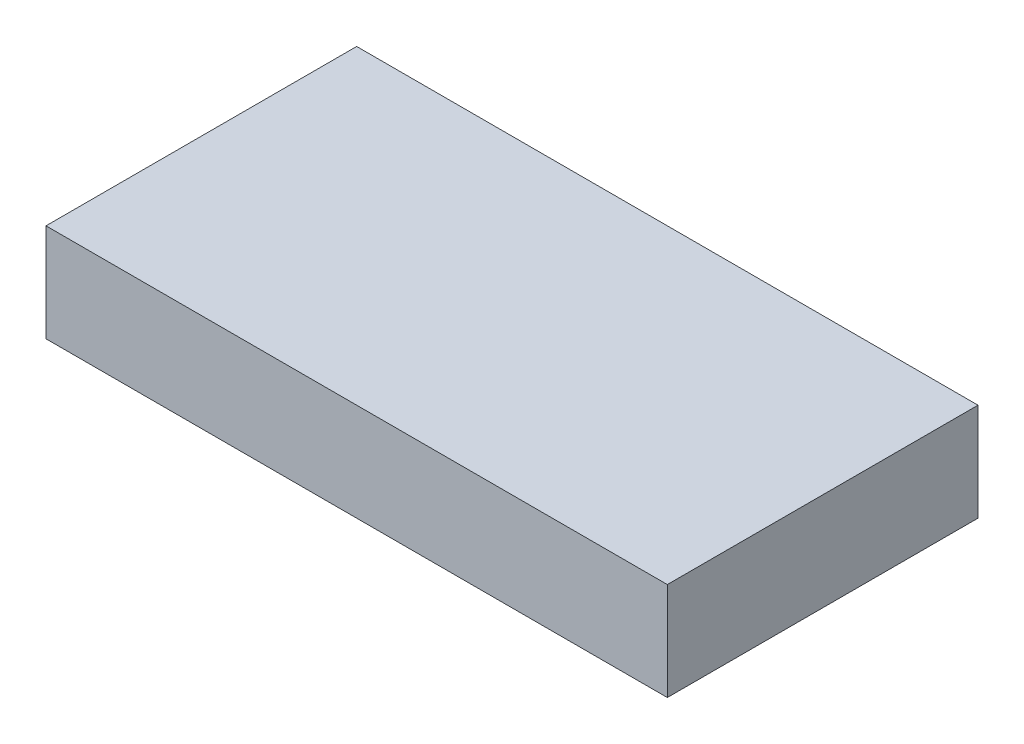
from build123d import *

# Parameters (mm, degrees)
SKETCH1_W           = 40
SKETCH1_H           = 20
BOSS_EXTRUDE1_DEPTH = 6.3


with BuildPart() as part:
    # Sketch1 → Boss-Extrude1 (new body)
    with BuildSketch(Plane(origin=(0, 0, 0), x_dir=(1, 0, 0), z_dir=(0, 1, 0))):
        with Locations((20, 10)):
            Rectangle(SKETCH1_W, SKETCH1_H)
    extrude(amount=-BOSS_EXTRUDE1_DEPTH)


solid = part.part
